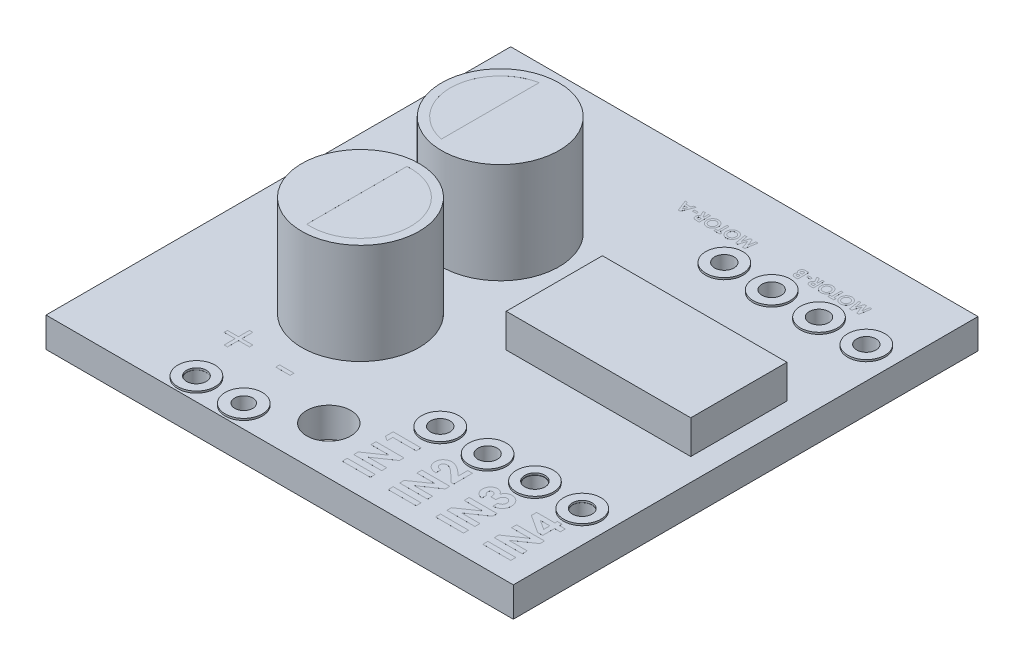
from build123d import *

# Parameters (mm, degrees)
SKETCH1_W                = 25.07
SKETCH1_H                = 24.93
BOSS_EXTRUDE1_DEPTH      = 1.6
SKETCH2_R                = 0.52
CUT_EXTRUDE1_DEPTH       = 1.6
LPATTERN1_COUNT          = 2
LPATTERN1_PITCH          = 2.54
SKETCH3_W                = 9.9
SKETCH3_H                = 5.16
BOSS_EXTRUDE2_DEPTH      = 1.8
SKETCH4_R                = 3.15
BOSS_EXTRUDE3_DEPTH      = 5.4
BOSS_EXTRUDE3_2_DEPTH    = 5.4
SKETCH7_R                = 1.185
CUT_EXTRUDE2_DEPTH       = 1.66
CUT_EXTRUDE3_DEPTH       = 0.001
SKETCH9_W                = 0.769230769
SKETCH9_H                = 0.205128205
BOSS_EXTRUDE4_DEPTH      = 0.001
SKETCH10_W               = 1.5
SKETCH10_H               = 0.269230769
BOSS_EXTRUDE5_DEPTH      = 0.001
SKETCH11_W               = 0.207692308
SKETCH11_H               = 0.1
SKETCH11_W_2             = 0.207692307
BOSS_EXTRUDE6_DEPTH      = 0.001
BOSS_EXTRUDE7_DEPTH      = 0.1
BOSS_EXTRUDE7_DEPTH_BACK = 1.7
SKETCH12_R               = 1
SKETCH12_R_2             = 0.52
SKETCH12_R_3             = 0.52732385
SKETCH12_R_4             = 0.484735271
SKETCH12_R_5             = 0.542856602
SKETCH12_R_6             = 0.528647699


with BuildPart() as part:
    # Sketch1 → Boss-Extrude1 (new body)
    with BuildSketch(Plane(origin=(0, 0, 0), x_dir=(1, 0, 0), z_dir=(0, 1, 0))):
        Rectangle(SKETCH1_W, SKETCH1_H)
    extrude(amount=BOSS_EXTRUDE1_DEPTH)

    # Sketch2 → Cut-Extrude1 (cut)
    with BuildSketch(Plane(origin=(0, 1.6, 0), x_dir=(1, 0, 0), z_dir=(0, 1, 0))):
        with Locations(Location((10.935, 8.075, 0), (0, 0, 270))):
            Circle(SKETCH2_R)
        with Locations(Location((10.935, -7.165, 0), (0, 0, 270))):
            Circle(SKETCH2_R)
        with Locations(Location((5.855, -7.165, 0), (0, 0, 270))):
            Circle(SKETCH2_R)
        with Locations(Location((5.855, 8.075, 0), (0, 0, 270))):
            Circle(SKETCH2_R)
        with Locations(Location((-3.035, -11.355, 0), (0, 0, 270))):
            Circle(SKETCH2_R)
    cut_extrude1 = extrude(amount=-CUT_EXTRUDE1_DEPTH, mode=Mode.SUBTRACT)

    # LPattern1: Cut-Extrude1 ×2
    with Locations(*[(-i * LPATTERN1_PITCH, 0, 0) for i in range(1, LPATTERN1_COUNT)]):
        add(cut_extrude1, mode=Mode.SUBTRACT)

    # Sketch7 → Cut-Extrude2 (cut)
    with BuildSketch(Plane(origin=(0, 1.6, 0), x_dir=(1, 0, 0), z_dir=(0, 1, 0))):
        with Locations(Location((0.075, -9.905, 0), (0, 0, 270))):
            Circle(SKETCH7_R)
    extrude(amount=-CUT_EXTRUDE2_DEPTH, mode=Mode.SUBTRACT)

    # Sketch9 → Boss-Extrude4 (add)
    with BuildSketch(Plane(origin=(0, 1.6, 0), x_dir=(1, 0, 0), z_dir=(0, 1, 0))):
        Polygon((-6.363977104, -8.310658231), (-6.363977104, -7.720914641), (-6.184489924, -7.720914641), (-6.184489924, -8.310658231), (-5.594746335, -8.310658231), (-5.594746335, -8.49014541), (-6.184489924, -8.49014541), (-6.184489924, -9.079889), (-6.363977104, -9.079889), (-6.363977104, -8.49014541), (-6.953720694, -8.49014541), (-6.953720694, -8.310658231), align=None)
        with Locations((-3.567566848, -8.618350538)):
            Rectangle(SKETCH9_W, SKETCH9_H)
    extrude(amount=BOSS_EXTRUDE4_DEPTH)

    # Sketch10 → Boss-Extrude5 (add)
    # profile 1 of 12: a face of its own
    with BuildSketch(Plane(origin=(0, 1.6, 0), x_dir=(1, 0, 0), z_dir=(0, 1, 0))):
        Polygon((2.203422881, -8.99396824), (2.203422881, -8.577802374), (3.703422881, -8.577802374), (3.703422881, -8.847033143), (2.453422881, -8.847033143), (2.453422881, -9.154725451), align=None)
    # profile 2 of 12: a face of its own
    with BuildSketch(Plane(origin=(0, 1.6, 0), x_dir=(1, 0, 0), z_dir=(0, 1, 0))):
        Polygon((2.203422881, -10.69318699), (2.203422881, -10.450699009), (3.190502208, -9.770110066), (2.203422881, -9.770110066), (2.203422881, -9.500879297), (3.703422881, -9.500879297), (3.703422881, -9.745170163), (2.719348361, -10.42395622), (3.703422881, -10.42395622), (3.703422881, -10.69318699), align=None)
    # profile 3 of 12: a face of its own
    with BuildSketch(Plane(origin=(0, 1.6, 0), x_dir=(1, 0, 0), z_dir=(0, 1, 0))):
        with Locations((2.953422881, -11.173956221)):
            Rectangle(SKETCH10_W, SKETCH10_H)
    # profile 4 of 12: a face of its own
    with BuildSketch(Plane(origin=(0, 1.6, 0), x_dir=(1, 0, 0), z_dir=(0, 1, 0))):
        with BuildLine():
            Line((5.255, -9.071812896), (5.255, -9.341043666))
            add(Edge.make_bspline(
                [(5.255, -9.341043666), (5.234633904, -9.339881356), (5.194839774, -9.337610272), (5.1370411, -9.328566566), (5.082414347, -9.316479449), (5.031123742, -9.300209891), (4.983147738, -9.28017028), (4.938645252, -9.255861854), (4.897297404, -9.228010375), (4.859829351, -9.196054445), (4.826144433, -9.161291), (4.796696193, -9.123809162), (4.772044164, -9.083715403), (4.751821993, -9.041277821), (4.735641652, -8.996663106), (4.724829479, -8.949420489), (4.717505786, -8.899966825), (4.716865037, -8.866111486), (4.716538462, -8.848856166)],
                knots=[0, 0, 0, 0, 1.198928049, 2.342633425, 3.435730849, 4.486331048, 5.502589352, 6.488331875, 7.46361919, 8.428949135, 9.378681775, 10.305958057, 11.226249248, 12.140413166, 13.066341608, 14.010670971, 14.986082777, 16, 16, 16, 16], degree=3))
            add(Edge.make_bspline(
                [(4.716538462, -8.848856166), (4.717154926, -8.827665993), (4.718358939, -8.786279632), (4.729986855, -8.726341858), (4.747793102, -8.670063713), (4.773663124, -8.618043838), (4.80628543, -8.570372676), (4.845257911, -8.527315261), (4.891054017, -8.489711352), (4.942354937, -8.457854215), (4.996783884, -8.431510041), (5.052962884, -8.412871965), (5.109441982, -8.400685907), (5.147467646, -8.399383158), (5.166358173, -8.398735973)],
                knots=[0, 0, 0, 0, 1.075374184, 2.100304875, 3.089917907, 4.066149699, 5.039978333, 6.01615708, 7.006437042, 8.039858286, 9.077679641, 10.07047942, 11.041445745, 12, 12, 12, 12], degree=3))
            add(Edge.make_bspline(
                [(5.166358173, -8.398735973), (5.17778472, -8.39898763), (5.200783535, -8.399494152), (5.235586388, -8.403016066), (5.271037162, -8.408299635), (5.307105466, -8.416265963), (5.343801391, -8.426200651), (5.38123483, -8.438252773), (5.419193258, -8.452702317), (5.458105037, -8.469306481), (5.498091908, -8.489120881), (5.539772216, -8.512169003), (5.583101589, -8.539221396), (5.628505028, -8.569397424), (5.675289274, -8.603884219), (5.723973829, -8.64176826), (5.774481981, -8.683240243), (5.808259141, -8.712651609), (5.825612981, -8.727762416)],
                knots=[0, 0, 0, 0, 0.728277616, 1.465842947, 2.227925269, 3.011838508, 3.818735656, 4.650581052, 5.517389122, 6.406849312, 7.346234817, 8.360743166, 9.441530624, 10.601362564, 11.834937575, 13.145232671, 14.533293658, 16, 16, 16, 16], degree=3))
            Line((5.825612981, -8.727762416), (6.005, -8.884312896))
            Line((6.005, -8.884312896), (6.005, -8.379505204))
            Line((6.005, -8.379505204), (6.255, -8.379505204))
            Line((6.255, -8.379505204), (6.255, -9.379505204))
            Line((6.255, -9.379505204), (6.118581731, -9.379505204))
            Line((6.118581731, -9.379505204), (5.645925481, -8.935394627))
            add(Edge.make_bspline(
                [(5.645925481, -8.935394627), (5.632138088, -8.922536281), (5.605435998, -8.897633478), (5.566218897, -8.862202662), (5.529010838, -8.830129104), (5.493380329, -8.802129964), (5.460533774, -8.776511214), (5.429229448, -8.755079245), (5.400348934, -8.736414627), (5.365144738, -8.71691746), (5.323474587, -8.697975447), (5.275498535, -8.680605924), (5.229612325, -8.67012413), (5.199658353, -8.668666172), (5.185288462, -8.667966742)],
                knots=[0, 0, 0, 0, 1.246192343, 2.413505005, 3.49357156, 4.492416076, 5.408771964, 6.246246772, 6.999304986, 7.680960093, 8.904522682, 10.020616941, 11.0504258, 12, 12, 12, 12], degree=3))
            add(Edge.make_bspline(
                [(5.185288462, -8.667966742), (5.171386204, -8.668488309), (5.14444835, -8.669498928), (5.106129397, -8.680604814), (5.071435497, -8.697810437), (5.041403343, -8.722055591), (5.01672393, -8.751424065), (4.998368076, -8.785362095), (4.987776832, -8.823592987), (4.986451187, -8.850393571), (4.985769231, -8.864180685)],
                knots=[0, 0, 0, 0, 1.062038974, 2.057870785, 3.028805853, 4.01125022, 4.991535629, 5.949134679, 6.94496649, 8, 8, 8, 8], degree=3))
            add(Edge.make_bspline(
                [(4.985769231, -8.864180685), (4.986021154, -8.871303283), (4.986517104, -8.885325263), (4.989818512, -8.905936477), (4.995636899, -8.925549527), (5.003432718, -8.944382719), (5.013766132, -8.962235059), (5.026503712, -8.979061518), (5.041321766, -8.995039384), (5.05817396, -9.010095377), (5.076981014, -9.023798295), (5.097571163, -9.035969177), (5.119931627, -9.046032471), (5.143767213, -9.05489256), (5.169333935, -9.061725885), (5.19647878, -9.066701393), (5.225157584, -9.07048394), (5.244871566, -9.071361852), (5.255, -9.071812896)],
                knots=[0, 0, 0, 0, 0.903469896, 1.778625579, 2.63899355, 3.493148037, 4.358286772, 5.247621495, 6.164656832, 7.118446693, 8.109501108, 9.111810964, 10.146451449, 11.215617525, 12.33435995, 13.498009769, 14.714554818, 16, 16, 16, 16], degree=3))
        make_face()
    # profile 5 of 12: a face of its own
    with BuildSketch(Plane(origin=(0, 1.6, 0), x_dir=(1, 0, 0), z_dir=(0, 1, 0))):
        Polygon((4.755, -10.783351358), (4.755, -10.540863377), (5.742079327, -9.860274435), (4.755, -9.860274435), (4.755, -9.591043666), (6.255, -9.591043666), (6.255, -9.835334531), (5.270925481, -10.514120589), (6.255, -10.514120589), (6.255, -10.783351358), align=None)
    # profile 6 of 12: a face of its own
    with BuildSketch(Plane(origin=(0, 1.6, 0), x_dir=(1, 0, 0), z_dir=(0, 1, 0))):
        with Locations((5.505, -11.264120589)):
            Rectangle(SKETCH10_W, SKETCH10_H)
    # profile 7 of 12: a face of its own
    with BuildSketch(Plane(origin=(0, 1.6, 0), x_dir=(1, 0, 0), z_dir=(0, 1, 0))):
        with BuildLine():
            Line((7.660384615, -9.014120589), (7.660384615, -9.283351358))
            add(Edge.make_bspline(
                [(7.660384615, -9.283351358), (7.646923785, -9.281462344), (7.620631451, -9.277772633), (7.582475644, -9.26870231), (7.546192287, -9.25821303), (7.5119761, -9.244798725), (7.479863969, -9.22931433), (7.449827158, -9.211257424), (7.421434614, -9.191465859), (7.404419841, -9.175970301), (7.395961538, -9.168267223)],
                knots=[0, 0, 0, 0, 1.1115466, 2.171125598, 3.205689823, 4.19946166, 5.17440286, 6.118867946, 7.064860634, 8, 8, 8, 8], degree=3))
            add(Edge.make_bspline(
                [(7.395961538, -9.168267223), (7.384784168, -9.157183956), (7.362754744, -9.135340001), (7.334537486, -9.09883619), (7.310117369, -9.060573455), (7.290756923, -9.01978442), (7.275086885, -8.977103793), (7.264561285, -8.932192162), (7.257577456, -8.885233054), (7.256889525, -8.85318937), (7.256538462, -8.836836935)],
                knots=[0, 0, 0, 0, 1.01925491, 2.00884431, 2.983262333, 3.955970413, 4.92937149, 5.924503185, 6.940838805, 8, 8, 8, 8], degree=3))
            add(Edge.make_bspline(
                [(7.256538462, -8.836836935), (7.256881679, -8.822298779), (7.257556375, -8.793719693), (7.26297247, -8.751715629), (7.272471698, -8.711668269), (7.284891724, -8.6731543), (7.301791247, -8.636740139), (7.321407995, -8.601622088), (7.345468752, -8.568781348), (7.372654986, -8.538141078), (7.402059559, -8.509992146), (7.43349063, -8.485615047), (7.466108602, -8.464657618), (7.500184468, -8.447391468), (7.53577589, -8.434116146), (7.57267726, -8.424902678), (7.610807152, -8.41887224), (7.636723527, -8.418271451), (7.649867788, -8.417966742)],
                knots=[0, 0, 0, 0, 1.091422571, 2.145516843, 3.172569842, 4.178562979, 5.178154469, 6.181868002, 7.194278174, 8.227918432, 9.254613415, 10.245994977, 11.209837596, 12.161663635, 13.10878368, 14.055455738, 15.013766427, 16, 16, 16, 16], degree=3))
            add(Edge.make_bspline(
                [(7.649867788, -8.417966742), (7.666142972, -8.418604061), (7.698281955, -8.419862589), (7.745227197, -8.429815699), (7.790013276, -8.445815892), (7.832109541, -8.468565794), (7.87147214, -8.497134701), (7.906726315, -8.532169052), (7.938418038, -8.572691177), (7.955449388, -8.60311083), (7.964170673, -8.618687896)],
                knots=[0, 0, 0, 0, 0.992776698, 1.96045919, 2.915875678, 3.886951799, 4.871409521, 5.874469288, 6.911574252, 8, 8, 8, 8], degree=3))
            add(Edge.make_bspline(
                [(7.964170673, -8.618687896), (7.967680588, -8.607995637), (7.974577414, -8.586985827), (7.988169025, -8.55712893), (8.00299084, -8.528715064), (8.020293725, -8.502394045), (8.038878373, -8.477444081), (8.059744027, -8.454654555), (8.082355098, -8.43343534), (8.106952125, -8.414311373), (8.13312615, -8.397213661), (8.160406731, -8.382145614), (8.188893576, -8.36950069), (8.218377346, -8.358887869), (8.249148208, -8.35079058), (8.281101885, -8.345093844), (8.314161386, -8.341799919), (8.336559332, -8.341297638), (8.347884615, -8.341043666)],
                knots=[0, 0, 0, 0, 1.059375415, 2.081625174, 3.086260357, 4.075579879, 5.045586876, 6.014170127, 6.982201689, 7.963705737, 8.945119069, 9.924852636, 10.896327119, 11.878239286, 12.873838556, 13.889973282, 14.933087432, 16, 16, 16, 16], degree=3))
            add(Edge.make_bspline(
                [(8.347884615, -8.341043666), (8.36452817, -8.341558545), (8.397345869, -8.342573781), (8.445682891, -8.34902834), (8.491768295, -8.361045097), (8.536130718, -8.376855355), (8.57820355, -8.397938732), (8.618929138, -8.422771598), (8.656926372, -8.453167797), (8.692924452, -8.487254284), (8.725811949, -8.524911676), (8.754868417, -8.565433472), (8.778820866, -8.608898182), (8.799293926, -8.654254996), (8.814488156, -8.702525704), (8.825615097, -8.753085889), (8.832385066, -8.806304762), (8.833097628, -8.842626239), (8.833461538, -8.861175877)],
                knots=[0, 0, 0, 0, 1.005228408, 1.982105694, 2.937129188, 3.876607107, 4.82066901, 5.774063015, 6.75178259, 7.752926466, 8.764612432, 9.766578198, 10.757677051, 11.756882247, 12.76686714, 13.807379907, 14.880213281, 16, 16, 16, 16], degree=3))
            add(Edge.make_bspline(
                [(8.833461538, -8.861175877), (8.833078734, -8.878723909), (8.832330212, -8.913036762), (8.825851368, -8.963226492), (8.815400468, -9.01092708), (8.800669058, -9.056260258), (8.781564936, -9.099050635), (8.758816214, -9.139686253), (8.731110797, -9.177356235), (8.699699361, -9.212480299), (8.664457514, -9.244279289), (8.626201615, -9.272700097), (8.584786192, -9.29711604), (8.540388191, -9.317627248), (8.492929722, -9.334073369), (8.442507296, -9.347046022), (8.389022403, -9.356107632), (8.352223658, -9.358867364), (8.333461538, -9.360274435)],
                knots=[0, 0, 0, 0, 1.066544725, 2.085487077, 3.070979577, 4.031932826, 4.977951092, 5.916076795, 6.857635327, 7.814973522, 8.776389752, 9.738577119, 10.707772778, 11.69409279, 12.707140348, 13.757286496, 14.856535458, 16, 16, 16, 16], degree=3))
            Line((8.333461538, -9.360274435), (8.333461538, -9.091043666))
            add(Edge.make_bspline(
                [(8.333461538, -9.091043666), (8.342895221, -9.089337245), (8.361269793, -9.086013545), (8.387874703, -9.079536733), (8.412423015, -9.071074345), (8.435095079, -9.061399324), (8.45612357, -9.050702453), (8.47494615, -9.037921546), (8.492302547, -9.024217579), (8.512252557, -9.003617394), (8.53317436, -8.974875416), (8.551703667, -8.935960468), (8.562241982, -8.892473794), (8.563553098, -8.862133953), (8.564230769, -8.846452319)],
                knots=[0, 0, 0, 0, 0.928450228, 1.808400301, 2.64896863, 3.43999153, 4.194978884, 4.9294959, 5.640047715, 6.332896648, 7.70085756, 9.063442004, 10.482192841, 12, 12, 12, 12], degree=3))
            add(Edge.make_bspline(
                [(8.564230769, -8.846452319), (8.564087259, -8.838129938), (8.563806154, -8.821828256), (8.560718767, -8.797877399), (8.555574782, -8.77508421), (8.548773757, -8.753259398), (8.539544803, -8.732745948), (8.528834633, -8.713079398), (8.515723764, -8.694619409), (8.500785172, -8.677473517), (8.484833507, -8.661516414), (8.467378204, -8.647890896), (8.449257407, -8.636127306), (8.429991816, -8.626845041), (8.41018961, -8.61907636), (8.389221391, -8.614231155), (8.367542304, -8.610594747), (8.352708666, -8.610382271), (8.345180288, -8.610274435)],
                knots=[0, 0, 0, 0, 1.110702965, 2.175618623, 3.217100552, 4.227908035, 5.221854906, 6.215531843, 7.213608581, 8.237687243, 9.249555755, 10.220750668, 11.188994735, 12.127982202, 13.071814005, 14.022160605, 14.996205625, 16, 16, 16, 16], degree=3))
            add(Edge.make_bspline(
                [(8.345180288, -8.610274435), (8.336944046, -8.610548659), (8.320646093, -8.611091297), (8.296762223, -8.615866482), (8.273698898, -8.62301423), (8.251646408, -8.633294018), (8.230734445, -8.646745579), (8.210789818, -8.663101297), (8.191971316, -8.682509131), (8.17373087, -8.704319164), (8.157763269, -8.729411393), (8.143059497, -8.756772555), (8.131351671, -8.787076714), (8.120896967, -8.819596869), (8.113260376, -8.854944476), (8.107715652, -8.892901106), (8.10358841, -8.933405216), (8.102996293, -8.96132524), (8.102692308, -8.97565905)],
                knots=[0, 0, 0, 0, 0.809868251, 1.602574917, 2.388262527, 3.182133002, 3.988875265, 4.829537611, 5.714850619, 6.646378958, 7.622533229, 8.636771727, 9.698525113, 10.814716514, 11.996253919, 13.252421425, 14.589425562, 16, 16, 16, 16], degree=3))
            Line((8.102692308, -8.97565905), (7.852692308, -8.97565905))
            add(Edge.make_bspline(
                [(7.852692308, -8.97565905), (7.851178126, -8.957810428), (7.848345392, -8.92441919), (7.841627698, -8.878102238), (7.832937539, -8.838976569), (7.821611908, -8.806594967), (7.808382754, -8.779262124), (7.79305456, -8.755719549), (7.775452997, -8.735179358), (7.755603714, -8.718284194), (7.734797617, -8.704204561), (7.712669248, -8.694566309), (7.690099029, -8.68810607), (7.674650135, -8.687498542), (7.666995192, -8.687197512)],
                knots=[0, 0, 0, 0, 1.700711886, 3.181695139, 4.441392523, 5.500267777, 6.431839453, 7.31822765, 8.161090383, 8.990537424, 9.787217293, 10.536619396, 11.274893404, 12, 12, 12, 12], degree=3))
            add(Edge.make_bspline(
                [(7.666995192, -8.687197512), (7.657227324, -8.687714723), (7.638162513, -8.688724209), (7.61082809, -8.696718194), (7.5863326, -8.710284317), (7.564950034, -8.728691384), (7.547507994, -8.751304666), (7.534535607, -8.777475421), (7.526967994, -8.807071038), (7.526177868, -8.827878571), (7.525769231, -8.838639819)],
                knots=[0, 0, 0, 0, 1.009324788, 1.969988301, 2.915956825, 3.885795408, 4.868116622, 5.850437836, 6.888288533, 8, 8, 8, 8], degree=3))
            add(Edge.make_bspline(
                [(7.525769231, -8.838639819), (7.526249392, -8.848394835), (7.52720218, -8.867751775), (7.534313536, -8.896057415), (7.546284619, -8.922938342), (7.562792037, -8.947837929), (7.582616746, -8.970396744), (7.606094998, -8.988911023), (7.631820172, -9.004310323), (7.650825808, -9.01083768), (7.660384615, -9.014120589)],
                knots=[0, 0, 0, 0, 0.98818071, 1.960853194, 2.938124878, 3.957524365, 4.978590984, 5.968022688, 6.978025184, 8, 8, 8, 8], degree=3))
        make_face()
    # profile 8 of 12: a face of its own
    with BuildSketch(Plane(origin=(0, 1.6, 0), x_dir=(1, 0, 0), z_dir=(0, 1, 0))):
        Polygon((7.295, -10.783351358), (7.295, -10.540863377), (8.282079327, -9.860274435), (7.295, -9.860274435), (7.295, -9.591043666), (8.795, -9.591043666), (8.795, -9.835334531), (7.810925481, -10.514120589), (8.795, -10.514120589), (8.795, -10.783351358), align=None)
    # profile 9 of 12: a face of its own
    with BuildSketch(Plane(origin=(0, 1.6, 0), x_dir=(1, 0, 0), z_dir=(0, 1, 0))):
        with Locations((8.045, -11.264120589)):
            Rectangle(SKETCH10_W, SKETCH10_H)
    # profile 10 of 12: a face of its own
    with BuildSketch(Plane(origin=(0, 1.6, 0), x_dir=(1, 0, 0), z_dir=(0, 1, 0))):
        Polygon((9.796538462, -8.756308089), (9.796538462, -8.47565905), (10.777307692, -8.47565905), (10.777307692, -8.341043666), (11.027307692, -8.341043666), (11.027307692, -8.47565905), (11.335, -8.47565905), (11.335, -8.744889819), (11.027307692, -8.744889819), (11.027307692, -9.379505204), (10.754771635, -9.379505204), align=None)
        Polygon((10.777307692, -8.744889819), (10.266790865, -8.744889819), (10.777307692, -9.076921069), align=None, mode=Mode.SUBTRACT)
    # profile 11 of 12: a face of its own
    with BuildSketch(Plane(origin=(0, 1.6, 0), x_dir=(1, 0, 0), z_dir=(0, 1, 0))):
        Polygon((9.835, -10.783351358), (9.835, -10.540863377), (10.822079327, -9.860274435), (9.835, -9.860274435), (9.835, -9.591043666), (11.335, -9.591043666), (11.335, -9.835334531), (10.350925481, -10.514120589), (11.335, -10.514120589), (11.335, -10.783351358), align=None)
    # profile 12 of 12: a face of its own
    with BuildSketch(Plane(origin=(0, 1.6, 0), x_dir=(1, 0, 0), z_dir=(0, 1, 0))):
        with Locations((10.585, -11.264120589)):
            Rectangle(SKETCH10_W, SKETCH10_H)
    extrude(amount=BOSS_EXTRUDE5_DEPTH)

    # Sketch11 → Boss-Extrude6 (add)
    # profile 1 of 14: a face of its own
    with BuildSketch(Plane(origin=(0, 1.6, 0), x_dir=(1, 0, 0), z_dir=(0, 1, 0))):
        Polygon((9.233145959, 9.372522891), (9.121367113, 9.372522891), (8.984468074, 9.791032506), (8.846607498, 9.372522891), (8.735910382, 9.372522891), (8.634468074, 9.972522891), (8.743482498, 9.972522891), (8.807544998, 9.593556544), (8.932304613, 9.972522891), (9.03735269, 9.972522891), (9.161391151, 9.593556544), (9.225333459, 9.972522891), (9.334468074, 9.972522891), align=None)
    # profile 2 of 14: a face of its own
    with BuildSketch(Plane(origin=(0, 1.6, 0), x_dir=(1, 0, 0), z_dir=(0, 1, 0))):
        with BuildLine():
            add(Edge.make_bspline(
                [(8.252496921, 9.357138275), (8.242065133, 9.357408263), (8.221470422, 9.35794128), (8.191183936, 9.362387743), (8.161993805, 9.369624279), (8.133895848, 9.379725318), (8.10698589, 9.392807069), (8.081165058, 9.408690859), (8.056504112, 9.427511468), (8.033290573, 9.449000326), (8.012004326, 9.472497719), (7.993293473, 9.497549325), (7.97741033, 9.523896497), (7.964517945, 9.551544369), (7.954449922, 9.580454962), (7.947452765, 9.610639248), (7.942941163, 9.642058576), (7.942423483, 9.663452665), (7.942160382, 9.674325775)],
                knots=[0, 0, 0, 0, 1.014151002, 2.002163778, 2.969868608, 3.93493411, 4.9003771, 5.874719092, 6.87846472, 7.912488755, 8.947011879, 9.957751389, 10.948740761, 11.933621513, 12.919426746, 13.920294397, 14.943031967, 16, 16, 16, 16], degree=3))
            add(Edge.make_bspline(
                [(7.942160382, 9.674325775), (7.942440661, 9.68507635), (7.942992961, 9.706260702), (7.947268036, 9.737390783), (7.954386806, 9.76725065), (7.964260729, 9.79585051), (7.976927689, 9.823190833), (7.992568265, 9.849182903), (8.011079699, 9.873880124), (8.032083855, 9.897131193), (8.055064949, 9.918373526), (8.07955089, 9.937021685), (8.10531419, 9.952706508), (8.132190243, 9.965725248), (8.160432595, 9.975508461), (8.189728125, 9.982831224), (8.220321897, 9.987065649), (8.241105974, 9.987624065), (8.251655574, 9.987907506)],
                knots=[0, 0, 0, 0, 1.051517626, 2.07204922, 3.067438659, 4.05042616, 5.027204762, 6.009981242, 7.012629434, 8.042243656, 9.071350414, 10.070091277, 11.048190212, 12.017682766, 12.985867053, 13.966945899, 14.968060614, 16, 16, 16, 16], degree=3))
            add(Edge.make_bspline(
                [(8.251655574, 9.987907506), (8.262690045, 9.987656226), (8.284371272, 9.987162496), (8.31610972, 9.98250695), (8.346474558, 9.975408951), (8.375382585, 9.965132756), (8.402811328, 9.951780271), (8.428883794, 9.935658165), (8.453403895, 9.916455017), (8.476289897, 9.894750026), (8.497022255, 9.870993846), (8.515323259, 9.845899147), (8.530760403, 9.819655706), (8.543334481, 9.79225174), (8.553247368, 9.763857428), (8.560239786, 9.734299876), (8.564370374, 9.703649964), (8.564945741, 9.682831931), (8.565237305, 9.672282506)],
                knots=[0, 0, 0, 0, 1.067953136, 2.098381936, 3.099641766, 4.083805132, 5.062469929, 6.048665414, 7.046702845, 8.073106546, 9.098695993, 10.09591865, 11.076726721, 12.041940862, 13.011263376, 13.984305721, 14.978557872, 16, 16, 16, 16], degree=3))
            add(Edge.make_bspline(
                [(8.565237305, 9.672282506), (8.565144533, 9.665185713), (8.564960164, 9.651081988), (8.562788002, 9.630175563), (8.559566422, 9.609707168), (8.555156156, 9.589638314), (8.54921406, 9.57002072), (8.541991926, 9.550804901), (8.533575863, 9.531990963), (8.523870679, 9.513749052), (8.51289218, 9.496297422), (8.501170105, 9.479483651), (8.488255474, 9.463749131), (8.474414851, 9.448922949), (8.459594023, 9.435072878), (8.443767177, 9.422151626), (8.426959226, 9.410192149), (8.409351969, 9.399095621), (8.391005637, 9.389376786), (8.372356724, 9.380567374), (8.353226202, 9.373424705), (8.333752972, 9.367508922), (8.313981804, 9.362761266), (8.293760048, 9.359604479), (8.273258371, 9.357415157), (8.259433828, 9.357230788), (8.252496921, 9.357138275)],
                knots=[0, 0, 0, 0, 1.034641744, 2.056182551, 3.061960284, 4.05571729, 5.050247014, 6.048716841, 7.047801973, 8.054190544, 9.059424999, 10.053182006, 11.041513076, 12.025412457, 13.009311837, 13.997642908, 15.002928308, 16.016213968, 17.030509951, 18.02913364, 19.022134519, 20.005478534, 20.996155877, 21.984625117, 22.988721131, 24, 24, 24, 24], degree=3))
        make_face()
        with BuildLine():
            add(Edge.make_bspline(
                [(8.254179613, 9.464830583), (8.261200169, 9.46501896), (8.275055938, 9.465390742), (8.295379832, 9.46822321), (8.314891467, 9.472747001), (8.333482785, 9.479299595), (8.351233976, 9.487639607), (8.368177956, 9.49773689), (8.384074592, 9.509942384), (8.399157043, 9.523586221), (8.412735608, 9.53885139), (8.424944578, 9.555032384), (8.434816025, 9.572518544), (8.44330406, 9.590733924), (8.449573787, 9.610139171), (8.45434753, 9.630419339), (8.456947626, 9.65178262), (8.457343037, 9.666306547), (8.457544998, 9.673724814)],
                knots=[0, 0, 0, 0, 1.033668485, 2.040047952, 3.016132939, 3.979056467, 4.937231767, 5.900589077, 6.877725736, 7.88429546, 8.891280164, 9.882584218, 10.863295226, 11.842887319, 12.837417301, 13.860812229, 14.907384602, 16, 16, 16, 16], degree=3))
            add(Edge.make_bspline(
                [(8.457544998, 9.673724814), (8.457299505, 9.681948212), (8.456818379, 9.698064709), (8.453482369, 9.721587624), (8.44763703, 9.743777125), (8.439651593, 9.764707441), (8.429036668, 9.784158479), (8.416340979, 9.802366051), (8.401246653, 9.819217187), (8.389638541, 9.829063779), (8.383746921, 9.834061352)],
                knots=[0, 0, 0, 0, 1.078343132, 2.113373867, 3.107373148, 4.082093053, 5.043582658, 6.005574554, 6.987742499, 8, 8, 8, 8], degree=3))
            add(Edge.make_bspline(
                [(8.383746921, 9.834061352), (8.378919273, 9.837752782), (8.369372745, 9.845052473), (8.354134408, 9.854408524), (8.338441922, 9.862427593), (8.322176867, 9.868906906), (8.305373593, 9.874003424), (8.288034406, 9.877572433), (8.270183873, 9.879812294), (8.258112506, 9.88008), (8.252016151, 9.880215198)],
                knots=[0, 0, 0, 0, 1.023928204, 2.024787132, 3.009472467, 3.9914905, 4.972207045, 5.96565515, 6.972602802, 8, 8, 8, 8], degree=3))
            add(Edge.make_bspline(
                [(8.252016151, 9.880215198), (8.245116447, 9.880024954), (8.231541063, 9.879650642), (8.211593601, 9.876856893), (8.192492191, 9.872108168), (8.174059784, 9.865659573), (8.156543201, 9.857017338), (8.139669287, 9.846755347), (8.123639148, 9.83455355), (8.108648203, 9.820565877), (8.094909803, 9.805299988), (8.082755142, 9.789031473), (8.072689079, 9.771759699), (8.064292702, 9.753715379), (8.057750989, 9.734754844), (8.053274135, 9.714876663), (8.050396946, 9.694161036), (8.050036377, 9.680064682), (8.04985269, 9.672883468)],
                knots=[0, 0, 0, 0, 1.026350473, 2.019376834, 2.989435443, 3.95094063, 4.91865229, 5.889827372, 6.885283771, 7.910196595, 8.935871797, 9.9372888, 10.925850568, 11.904605667, 12.894245083, 13.903507864, 14.931967858, 16, 16, 16, 16], degree=3))
            add(Edge.make_bspline(
                [(8.04985269, 9.672883468), (8.050042021, 9.665743253), (8.050414692, 9.651688829), (8.053224097, 9.631030669), (8.057894639, 9.611261712), (8.064495607, 9.592330998), (8.07271904, 9.574139144), (8.083049041, 9.556844038), (8.095261701, 9.540460643), (8.109133764, 9.525086362), (8.124230168, 9.510957435), (8.140438321, 9.498696336), (8.157303925, 9.488041768), (8.175214162, 9.479695425), (8.193802552, 9.473045907), (8.213182535, 9.468149108), (8.23342751, 9.46541064), (8.247200586, 9.465025659), (8.254179613, 9.464830583)],
                knots=[0, 0, 0, 0, 1.055040155, 2.076685641, 3.074845078, 4.052329834, 5.035358467, 6.020382375, 7.023447318, 8.050688466, 9.077178457, 10.074336316, 11.0503314, 12.019748348, 12.988025369, 13.964577102, 14.968620271, 16, 16, 16, 16], degree=3))
        make_face(mode=Mode.SUBTRACT)
    # profile 3 of 14: a face of its own
    with BuildSketch(Plane(origin=(0, 1.6, 0), x_dir=(1, 0, 0), z_dir=(0, 1, 0))):
        Polygon((7.896006536, 9.372522891), (7.572929613, 9.372522891), (7.572929613, 9.480215198), (7.680621921, 9.480215198), (7.680621921, 9.972522891), (7.788314228, 9.972522891), (7.788314228, 9.480215198), (7.896006536, 9.480215198), align=None)
    # profile 4 of 14: a face of its own
    with BuildSketch(Plane(origin=(0, 1.6, 0), x_dir=(1, 0, 0), z_dir=(0, 1, 0))):
        with BuildLine():
            add(Edge.make_bspline(
                [(7.206343074, 9.357138275), (7.195911287, 9.357408263), (7.175316576, 9.35794128), (7.145030089, 9.362387743), (7.115839959, 9.369624279), (7.087742002, 9.379725318), (7.060832044, 9.392807069), (7.035011212, 9.408690859), (7.010350266, 9.427511468), (6.987136727, 9.449000326), (6.96585048, 9.472497719), (6.947139627, 9.497549325), (6.931256484, 9.523896497), (6.918364099, 9.551544369), (6.908296076, 9.580454962), (6.901298918, 9.610639248), (6.896787317, 9.642058576), (6.896269637, 9.663452665), (6.896006536, 9.674325775)],
                knots=[0, 0, 0, 0, 1.014151002, 2.002163778, 2.969868608, 3.93493411, 4.9003771, 5.874719092, 6.87846472, 7.912488755, 8.947011879, 9.957751389, 10.948740761, 11.933621513, 12.919426746, 13.920294397, 14.943031967, 16, 16, 16, 16], degree=3))
            add(Edge.make_bspline(
                [(6.896006536, 9.674325775), (6.896286815, 9.68507635), (6.896839114, 9.706260702), (6.901114189, 9.737390783), (6.90823296, 9.76725065), (6.918106883, 9.79585051), (6.930773842, 9.823190833), (6.946414419, 9.849182903), (6.964925853, 9.873880124), (6.985930009, 9.897131193), (7.008911103, 9.918373526), (7.033397044, 9.937021685), (7.059160344, 9.952706508), (7.086036397, 9.965725248), (7.114278749, 9.975508461), (7.143574279, 9.982831224), (7.174168051, 9.987065649), (7.194952128, 9.987624065), (7.205501728, 9.987907506)],
                knots=[0, 0, 0, 0, 1.051517626, 2.07204922, 3.067438659, 4.05042616, 5.027204762, 6.009981242, 7.012629434, 8.042243656, 9.071350414, 10.070091277, 11.048190212, 12.017682766, 12.985867053, 13.966945899, 14.968060614, 16, 16, 16, 16], degree=3))
            add(Edge.make_bspline(
                [(7.205501728, 9.987907506), (7.216536199, 9.987656226), (7.238217426, 9.987162496), (7.269955874, 9.98250695), (7.300320712, 9.975408951), (7.329228739, 9.965132756), (7.356657482, 9.951780271), (7.382729948, 9.935658165), (7.407250049, 9.916455017), (7.430136051, 9.894750026), (7.450868409, 9.870993846), (7.469169413, 9.845899147), (7.484606557, 9.819655706), (7.497180635, 9.79225174), (7.507093522, 9.763857428), (7.51408594, 9.734299876), (7.518216528, 9.703649964), (7.518791895, 9.682831931), (7.519083459, 9.672282506)],
                knots=[0, 0, 0, 0, 1.067953136, 2.098381936, 3.099641766, 4.083805132, 5.062469929, 6.048665414, 7.046702845, 8.073106546, 9.098695993, 10.09591865, 11.076726721, 12.041940862, 13.011263376, 13.984305721, 14.978557872, 16, 16, 16, 16], degree=3))
            add(Edge.make_bspline(
                [(7.519083459, 9.672282506), (7.518990687, 9.665185713), (7.518806317, 9.651081988), (7.516634156, 9.630175563), (7.513412576, 9.609707168), (7.509002309, 9.589638314), (7.503060214, 9.57002072), (7.49583808, 9.550804901), (7.487422017, 9.531990963), (7.477716833, 9.513749052), (7.466738334, 9.496297422), (7.455016259, 9.479483651), (7.442101628, 9.463749131), (7.428261005, 9.448922949), (7.413440176, 9.435072878), (7.397613331, 9.422151626), (7.38080538, 9.410192149), (7.363198123, 9.399095621), (7.344851791, 9.389376786), (7.326202878, 9.380567374), (7.307072356, 9.373424705), (7.287599126, 9.367508922), (7.267827958, 9.362761266), (7.247606202, 9.359604479), (7.227104525, 9.357415157), (7.213279982, 9.357230788), (7.206343074, 9.357138275)],
                knots=[0, 0, 0, 0, 1.034641744, 2.056182551, 3.061960284, 4.05571729, 5.050247014, 6.048716841, 7.047801973, 8.054190544, 9.059424999, 10.053182006, 11.041513076, 12.025412457, 13.009311837, 13.997642908, 15.002928308, 16.016213968, 17.030509951, 18.02913364, 19.022134519, 20.005478534, 20.996155877, 21.984625117, 22.988721131, 24, 24, 24, 24], degree=3))
        make_face()
        with BuildLine():
            add(Edge.make_bspline(
                [(7.208025767, 9.464830583), (7.215046323, 9.46501896), (7.228902091, 9.465390742), (7.249225986, 9.46822321), (7.268737621, 9.472747001), (7.287328939, 9.479299595), (7.30508013, 9.487639607), (7.32202411, 9.49773689), (7.337920746, 9.509942384), (7.353003197, 9.523586221), (7.366581762, 9.53885139), (7.378790731, 9.555032384), (7.388662179, 9.572518544), (7.397150214, 9.590733924), (7.403419941, 9.610139171), (7.408193684, 9.630419339), (7.41079378, 9.65178262), (7.411189191, 9.666306547), (7.411391151, 9.673724814)],
                knots=[0, 0, 0, 0, 1.033668485, 2.040047952, 3.016132939, 3.979056467, 4.937231767, 5.900589077, 6.877725736, 7.88429546, 8.891280164, 9.882584218, 10.863295226, 11.842887319, 12.837417301, 13.860812229, 14.907384602, 16, 16, 16, 16], degree=3))
            add(Edge.make_bspline(
                [(7.411391151, 9.673724814), (7.411145658, 9.681948212), (7.410664533, 9.698064709), (7.407328523, 9.721587624), (7.401483184, 9.743777125), (7.393497746, 9.764707441), (7.382882822, 9.784158479), (7.370187133, 9.802366051), (7.355092806, 9.819217187), (7.343484695, 9.829063779), (7.337593074, 9.834061352)],
                knots=[0, 0, 0, 0, 1.078343132, 2.113373867, 3.107373148, 4.082093053, 5.043582658, 6.005574554, 6.987742499, 8, 8, 8, 8], degree=3))
            add(Edge.make_bspline(
                [(7.337593074, 9.834061352), (7.332765427, 9.837752782), (7.323218899, 9.845052473), (7.307980562, 9.854408524), (7.292288076, 9.862427593), (7.276023021, 9.868906906), (7.259219747, 9.874003424), (7.24188056, 9.877572433), (7.224030027, 9.879812294), (7.21195866, 9.88008), (7.205862305, 9.880215198)],
                knots=[0, 0, 0, 0, 1.023928204, 2.024787132, 3.009472467, 3.9914905, 4.972207045, 5.96565515, 6.972602802, 8, 8, 8, 8], degree=3))
            add(Edge.make_bspline(
                [(7.205862305, 9.880215198), (7.198962601, 9.880024954), (7.185387217, 9.879650642), (7.165439755, 9.876856893), (7.146338345, 9.872108168), (7.127905937, 9.865659573), (7.110389355, 9.857017338), (7.093515441, 9.846755347), (7.077485302, 9.83455355), (7.062494357, 9.820565877), (7.048755957, 9.805299988), (7.036601296, 9.789031473), (7.026535233, 9.771759699), (7.018138856, 9.753715379), (7.011597142, 9.734754844), (7.007120288, 9.714876663), (7.0042431, 9.694161036), (7.003882531, 9.680064682), (7.003698844, 9.672883468)],
                knots=[0, 0, 0, 0, 1.026350473, 2.019376834, 2.989435443, 3.95094063, 4.91865229, 5.889827372, 6.885283771, 7.910196595, 8.935871797, 9.9372888, 10.925850568, 11.904605667, 12.894245083, 13.903507864, 14.931967858, 16, 16, 16, 16], degree=3))
            add(Edge.make_bspline(
                [(7.003698844, 9.672883468), (7.003888175, 9.665743253), (7.004260845, 9.651688829), (7.007070251, 9.631030669), (7.011740793, 9.611261712), (7.018341761, 9.592330998), (7.026565194, 9.574139144), (7.036895195, 9.556844038), (7.049107855, 9.540460643), (7.062979918, 9.525086362), (7.078076322, 9.510957435), (7.094284475, 9.498696336), (7.111150079, 9.488041768), (7.129060316, 9.479695425), (7.147648706, 9.473045907), (7.167028689, 9.468149108), (7.187273664, 9.46541064), (7.20104674, 9.465025659), (7.208025767, 9.464830583)],
                knots=[0, 0, 0, 0, 1.055040155, 2.076685641, 3.074845078, 4.052329834, 5.035358467, 6.020382375, 7.023447318, 8.050688466, 9.077178457, 10.074336316, 11.0503314, 12.019748348, 12.988025369, 13.964577102, 14.968620271, 16, 16, 16, 16], degree=3))
        make_face(mode=Mode.SUBTRACT)
    # profile 5 of 14: a face of its own
    with BuildSketch(Plane(origin=(0, 1.6, 0), x_dir=(1, 0, 0), z_dir=(0, 1, 0))):
        with BuildLine():
            Line((6.788314228, 9.372522891), (6.662833459, 9.372522891))
            add(Edge.make_bspline(
                [(6.662833459, 9.372522891), (6.654539145, 9.372551809), (6.638586842, 9.372607429), (6.615585673, 9.373507654), (6.59445176, 9.374727641), (6.57513815, 9.376703792), (6.557666854, 9.378974555), (6.542073501, 9.382022901), (6.528300096, 9.385404531), (6.516177211, 9.389565804), (6.505263518, 9.394350341), (6.495130387, 9.39976671), (6.485524641, 9.405962309), (6.476516226, 9.412917249), (6.467827927, 9.420367392), (6.459924906, 9.428745739), (6.452454608, 9.437778066), (6.445495493, 9.447464958), (6.439247204, 9.457783803), (6.433859309, 9.468611241), (6.42922017, 9.479881593), (6.425548757, 9.491636041), (6.422620785, 9.503841122), (6.420662823, 9.516466554), (6.419208063, 9.529540564), (6.41912555, 9.538424031), (6.419083459, 9.542955583)],
                knots=[0, 0, 0, 0, 1.748592178, 3.36303531, 4.852592433, 6.210838904, 7.455605234, 8.565530618, 9.559147328, 10.443333557, 11.264119507, 12.069061813, 12.863340979, 13.67089394, 14.467102114, 15.273638367, 16.095597024, 16.937114566, 17.786018611, 18.63597263, 19.484582448, 20.352808207, 21.22970172, 22.128176732, 23.04516274, 24, 24, 24, 24], degree=3))
            add(Edge.make_bspline(
                [(6.419083459, 9.542955583), (6.419194246, 9.547685236), (6.419411479, 9.556959224), (6.420571912, 9.570583746), (6.422729294, 9.583650341), (6.425890479, 9.596075154), (6.429674233, 9.607985437), (6.434574558, 9.619195302), (6.440146982, 9.62990305), (6.446757685, 9.639932226), (6.454017177, 9.649498361), (6.462448217, 9.658254017), (6.471574417, 9.666614247), (6.481673493, 9.674294355), (6.49271521, 9.681246533), (6.504491939, 9.687753166), (6.517166434, 9.693698687), (6.526069261, 9.697024226), (6.530621921, 9.698724814)],
                knots=[0, 0, 0, 0, 1.099808295, 2.156523617, 3.176426857, 4.17500812, 5.135317955, 6.078349783, 7.015890908, 7.9382699, 8.868004242, 9.803692517, 10.759882289, 11.743580734, 12.748787378, 13.791075452, 14.870417076, 16, 16, 16, 16], degree=3))
            Line((6.530621921, 9.698724814), (6.392160382, 9.972522891))
            Line((6.392160382, 9.972522891), (6.511871921, 9.972522891))
            Line((6.511871921, 9.972522891), (6.644083459, 9.710984429))
            Line((6.644083459, 9.710984429), (6.680621921, 9.710984429))
            Line((6.680621921, 9.710984429), (6.680621921, 9.972522891))
            Line((6.680621921, 9.972522891), (6.788314228, 9.972522891))
            Line((6.788314228, 9.972522891), (6.788314228, 9.372522891))
        make_face()
        with BuildLine():
            Line((6.680621921, 9.603292121), (6.638674805, 9.603292121))
            add(Edge.make_bspline(
                [(6.638674805, 9.603292121), (6.633546421, 9.603234363), (6.623726667, 9.603123768), (6.609604584, 9.602610764), (6.596778319, 9.60137474), (6.585192989, 9.599812908), (6.574789664, 9.598010057), (6.565663159, 9.595424726), (6.55766643, 9.592659525), (6.550914293, 9.589206627), (6.54512188, 9.585348983), (6.540266655, 9.580773248), (6.535989376, 9.575760772), (6.532634242, 9.569996069), (6.52992351, 9.563715316), (6.528242401, 9.556800349), (6.5269086, 9.549376369), (6.526821232, 9.54420457), (6.526775767, 9.541513275)],
                knots=[0, 0, 0, 0, 1.688935225, 3.233948049, 4.651771667, 5.929878493, 7.083962697, 8.124219224, 9.050753627, 9.864999381, 10.615157594, 11.334035464, 12.05533055, 12.777108108, 13.522027315, 14.29964284, 15.115170198, 16, 16, 16, 16], degree=3))
            add(Edge.make_bspline(
                [(6.526775767, 9.541513275), (6.526891942, 9.538331643), (6.527118726, 9.532120796), (6.529570904, 9.523154275), (6.533270933, 9.514794782), (6.538509061, 9.507158109), (6.545043855, 9.500476475), (6.552532521, 9.494621905), (6.561118653, 9.489936033), (6.569046724, 9.486740115), (6.576378507, 9.484898002), (6.582951157, 9.483580339), (6.590576649, 9.48251289), (6.599244138, 9.481727295), (6.608937697, 9.480979786), (6.619680329, 9.480516997), (6.631462435, 9.480310491), (6.639676344, 9.480247877), (6.643963267, 9.480215198)],
                knots=[0, 0, 0, 0, 1.020050218, 1.991234449, 2.965145773, 3.94719294, 4.948794399, 5.958308566, 6.989992871, 8.082620171, 8.694688219, 9.416833949, 10.236190632, 11.167557654, 12.21328564, 13.36031274, 14.622320386, 16, 16, 16, 16], degree=3))
            Line((6.643963267, 9.480215198), (6.680621921, 9.480215198))
            Line((6.680621921, 9.480215198), (6.680621921, 9.603292121))
        make_face(mode=Mode.SUBTRACT)
    # profile 6 of 14: a face of its own
    with BuildSketch(Plane(origin=(0, 1.6, 0), x_dir=(1, 0, 0), z_dir=(0, 1, 0))):
        with Locations((6.19985269, 9.753292121)):
            Rectangle(SKETCH11_W, SKETCH11_H)
    # profile 7 of 14: a face of its own
    with BuildSketch(Plane(origin=(0, 1.6, 0), x_dir=(1, 0, 0), z_dir=(0, 1, 0))):
        with BuildLine():
            Line((5.957544998, 9.972522891), (5.957544998, 9.372522891))
            Line((5.957544998, 9.372522891), (5.861391151, 9.372522891))
            add(Edge.make_bspline(
                [(5.861391151, 9.372522891), (5.854659769, 9.372521972), (5.841634672, 9.372520194), (5.82284305, 9.373182122), (5.805454639, 9.374027022), (5.789448219, 9.375004013), (5.774829716, 9.376625446), (5.761589062, 9.378370414), (5.749775295, 9.380460835), (5.742471575, 9.38233722), (5.739035382, 9.383220006)],
                knots=[0, 0, 0, 0, 1.311970222, 2.538637508, 3.664491357, 4.705491327, 5.663608299, 6.530571107, 7.308675535, 8, 8, 8, 8], degree=3))
            add(Edge.make_bspline(
                [(5.739035382, 9.383220006), (5.734523343, 9.384465147), (5.725669273, 9.386908514), (5.712986751, 9.391842106), (5.700958187, 9.397329479), (5.689586209, 9.403577362), (5.679005313, 9.410702275), (5.669070457, 9.418568326), (5.659827852, 9.427178172), (5.651424825, 9.436582827), (5.643840218, 9.446534569), (5.637223182, 9.457038035), (5.631507532, 9.467926755), (5.62711872, 9.47938865), (5.62343323, 9.491124386), (5.620967558, 9.503372341), (5.619313147, 9.516027005), (5.619160795, 9.524640801), (5.619083459, 9.529013275)],
                knots=[0, 0, 0, 0, 1.099879008, 2.158315707, 3.195196496, 4.207130292, 5.205157476, 6.190838564, 7.183874245, 8.171129509, 9.152705923, 10.122275948, 11.08707516, 12.038677937, 13.004120747, 13.975884785, 14.972532894, 16, 16, 16, 16], degree=3))
            add(Edge.make_bspline(
                [(5.619083459, 9.529013275), (5.619271076, 9.534633791), (5.619640599, 9.545703723), (5.622476369, 9.561888162), (5.62704638, 9.577269265), (5.633504209, 9.591980204), (5.642173496, 9.605998702), (5.652984316, 9.619590691), (5.666205571, 9.632570589), (5.676178766, 9.640521265), (5.681343074, 9.644638275)],
                knots=[0, 0, 0, 0, 0.986462413, 1.942894939, 2.875435142, 3.798266677, 4.755009598, 5.761362919, 6.840791609, 8, 8, 8, 8], degree=3))
            add(Edge.make_bspline(
                [(5.681343074, 9.644638275), (5.67711234, 9.646797345), (5.668817039, 9.651030685), (5.657047444, 9.657997011), (5.646122673, 9.665376464), (5.636118546, 9.673157664), (5.626798187, 9.681186139), (5.618740295, 9.689953647), (5.611148776, 9.698783454), (5.604649489, 9.708244596), (5.599030212, 9.718134917), (5.594045158, 9.728342595), (5.589973336, 9.739070613), (5.586468225, 9.750165522), (5.583812099, 9.761741951), (5.582094243, 9.773727725), (5.580776343, 9.786115816), (5.580673971, 9.794554407), (5.580621921, 9.798845006)],
                knots=[0, 0, 0, 0, 1.164301211, 2.282872552, 3.350830854, 4.394111106, 5.389302619, 6.362088852, 7.310365691, 8.24222091, 9.170601078, 10.097577168, 11.024240953, 11.981127157, 12.948542686, 13.932080445, 14.948567018, 16, 16, 16, 16], degree=3))
            add(Edge.make_bspline(
                [(5.580621921, 9.798845006), (5.580942858, 9.807044002), (5.581576546, 9.823232842), (5.58670423, 9.846910632), (5.594888782, 9.869473761), (5.606364505, 9.890560529), (5.620347276, 9.909796712), (5.636358007, 9.926786132), (5.654412418, 9.941013741), (5.670957976, 9.950714654), (5.68534487, 9.957183022), (5.697310319, 9.961146398), (5.710153106, 9.964820001), (5.72401705, 9.967666089), (5.738833006, 9.969786734), (5.754594202, 9.971331746), (5.771354999, 9.972306154), (5.782864135, 9.972449184), (5.788794998, 9.972522891)],
                knots=[0, 0, 0, 0, 1.284225818, 2.535691644, 3.779474941, 5.035581115, 6.285533147, 7.498311102, 8.683187976, 9.876672238, 10.49522506, 11.152635743, 11.850557634, 12.588370465, 13.369094102, 14.195874568, 15.07030211, 16, 16, 16, 16], degree=3))
            Line((5.788794998, 9.972522891), (5.957544998, 9.972522891))
        make_face()
        with BuildLine():
            Line((5.84985269, 9.480215198), (5.84985269, 9.610984429))
            Line((5.84985269, 9.610984429), (5.821246921, 9.610984429))
            add(Edge.make_bspline(
                [(5.821246921, 9.610984429), (5.817359091, 9.610950681), (5.809853872, 9.610885531), (5.79901416, 9.610040521), (5.78893216, 9.608609509), (5.779621211, 9.606570545), (5.771026924, 9.604099831), (5.763251082, 9.600957319), (5.756268436, 9.597207811), (5.748041166, 9.591758871), (5.739566585, 9.58341449), (5.731978049, 9.571635794), (5.727530627, 9.558002378), (5.727032825, 9.548396624), (5.726775767, 9.543436352)],
                knots=[0, 0, 0, 0, 1.06517797, 2.056261606, 2.976983468, 3.853439442, 4.666321732, 5.424739265, 6.146762548, 6.834937974, 8.123729748, 9.372478121, 10.64318598, 12, 12, 12, 12], degree=3))
            add(Edge.make_bspline(
                [(5.726775767, 9.543436352), (5.726981384, 9.538789987), (5.727378937, 9.529806425), (5.731860011, 9.517184081), (5.738840648, 9.506056263), (5.746957899, 9.49833025), (5.754698246, 9.493135786), (5.761361111, 9.489672159), (5.768683332, 9.486596742), (5.776844536, 9.484449193), (5.78560017, 9.482433494), (5.79513882, 9.48120784), (5.80536396, 9.480303133), (5.812430478, 9.480245139), (5.816078651, 9.480215198)],
                knots=[0, 0, 0, 0, 1.347812291, 2.605940898, 3.848830773, 5.144272192, 5.83350599, 6.558918059, 7.32804622, 8.140548749, 9.012446266, 9.943019774, 10.938059685, 12, 12, 12, 12], degree=3))
            Line((5.816078651, 9.480215198), (5.84985269, 9.480215198))
        make_face(mode=Mode.SUBTRACT)
        with BuildLine():
            Line((5.84985269, 9.710984429), (5.84985269, 9.864830583))
            Line((5.84985269, 9.864830583), (5.818843074, 9.864830583))
            add(Edge.make_bspline(
                [(5.818843074, 9.864830583), (5.812712585, 9.864794928), (5.800925953, 9.864726377), (5.784039228, 9.863921059), (5.768693294, 9.862427408), (5.754884538, 9.860683497), (5.742725989, 9.857926087), (5.731995592, 9.85505909), (5.722879285, 9.851371326), (5.715221493, 9.84709484), (5.708816991, 9.842257369), (5.703271135, 9.837021982), (5.698645475, 9.831171979), (5.694925416, 9.824836768), (5.691800418, 9.818074807), (5.689886113, 9.810661642), (5.688435447, 9.802827813), (5.688355257, 9.797410141), (5.688314228, 9.794638275)],
                knots=[0, 0, 0, 0, 1.753677247, 3.371663338, 4.833688836, 6.164395063, 7.349095089, 8.3975697, 9.338276771, 10.154261968, 10.899224605, 11.628775934, 12.330426574, 13.024264642, 13.727131073, 14.452891561, 15.208446408, 16, 16, 16, 16], degree=3))
            add(Edge.make_bspline(
                [(5.688314228, 9.794638275), (5.688404266, 9.791468427), (5.688579634, 9.785294415), (5.690016431, 9.776272037), (5.69261595, 9.767842972), (5.695941287, 9.759788623), (5.700430744, 9.752328655), (5.70591483, 9.745413402), (5.712344798, 9.739022482), (5.719740954, 9.733059008), (5.728328386, 9.727702264), (5.738304628, 9.723369752), (5.749411941, 9.719461253), (5.761867773, 9.716439942), (5.775574587, 9.713848522), (5.790651192, 9.71230764), (5.806966349, 9.711159351), (5.818279795, 9.711044061), (5.824131536, 9.710984429)],
                knots=[0, 0, 0, 0, 0.844862234, 1.645564352, 2.426138401, 3.19188377, 3.963047654, 4.738710309, 5.53926994, 6.37496817, 7.267116735, 8.227971149, 9.268346748, 10.402975021, 11.641070045, 12.984514716, 14.440277492, 16, 16, 16, 16], degree=3))
            Line((5.824131536, 9.710984429), (5.84985269, 9.710984429))
        make_face(mode=Mode.SUBTRACT)
    # profile 8 of 14: a face of its own
    with BuildSketch(Plane(origin=(0, 1.6, 0), x_dir=(1, 0, 0), z_dir=(0, 1, 0))):
        Polygon((3.117761344, 9.372522891), (3.005982498, 9.372522891), (2.869083459, 9.791032506), (2.731222882, 9.372522891), (2.620525767, 9.372522891), (2.519083459, 9.972522891), (2.628097882, 9.972522891), (2.692160382, 9.593556544), (2.816919998, 9.972522891), (2.921968074, 9.972522891), (3.046006536, 9.593556544), (3.109948844, 9.972522891), (3.219083459, 9.972522891), align=None)
    # profile 9 of 14: a face of its own
    with BuildSketch(Plane(origin=(0, 1.6, 0), x_dir=(1, 0, 0), z_dir=(0, 1, 0))):
        with BuildLine():
            add(Edge.make_bspline(
                [(2.137112305, 9.357138275), (2.126680518, 9.357408263), (2.106085807, 9.35794128), (2.07579932, 9.362387743), (2.04660919, 9.369624279), (2.018511232, 9.379725318), (1.991601275, 9.392807069), (1.965780443, 9.408690859), (1.941119497, 9.427511468), (1.917905957, 9.449000326), (1.89661971, 9.472497719), (1.877908857, 9.497549325), (1.862025715, 9.523896497), (1.84913333, 9.551544369), (1.839065307, 9.580454962), (1.832068149, 9.610639248), (1.827556548, 9.642058576), (1.827038867, 9.663452665), (1.826775767, 9.674325775)],
                knots=[0, 0, 0, 0, 1.014151002, 2.002163778, 2.969868608, 3.93493411, 4.9003771, 5.874719092, 6.87846472, 7.912488755, 8.947011879, 9.957751389, 10.948740761, 11.933621513, 12.919426746, 13.920294397, 14.943031967, 16, 16, 16, 16], degree=3))
            add(Edge.make_bspline(
                [(1.826775767, 9.674325775), (1.827056046, 9.68507635), (1.827608345, 9.706260702), (1.83188342, 9.737390783), (1.839002191, 9.76725065), (1.848876114, 9.79585051), (1.861543073, 9.823190833), (1.877183649, 9.849182903), (1.895695084, 9.873880124), (1.916699239, 9.897131193), (1.939680334, 9.918373526), (1.964166275, 9.937021685), (1.989929575, 9.952706508), (2.016805628, 9.965725248), (2.04504798, 9.975508461), (2.074343509, 9.982831224), (2.104937282, 9.987065649), (2.125721359, 9.987624065), (2.136270959, 9.987907506)],
                knots=[0, 0, 0, 0, 1.051517626, 2.07204922, 3.067438659, 4.05042616, 5.027204762, 6.009981242, 7.012629434, 8.042243656, 9.071350414, 10.070091277, 11.048190212, 12.017682766, 12.985867053, 13.966945899, 14.968060614, 16, 16, 16, 16], degree=3))
            add(Edge.make_bspline(
                [(2.136270959, 9.987907506), (2.14730543, 9.987656226), (2.168986656, 9.987162496), (2.200725105, 9.98250695), (2.231089943, 9.975408951), (2.25999797, 9.965132756), (2.287426713, 9.951780271), (2.313499179, 9.935658165), (2.338019279, 9.916455017), (2.360905281, 9.894750026), (2.38163764, 9.870993846), (2.399938644, 9.845899147), (2.415375788, 9.819655706), (2.427949865, 9.79225174), (2.437862753, 9.763857428), (2.444855171, 9.734299876), (2.448985759, 9.703649964), (2.449561126, 9.682831931), (2.44985269, 9.672282506)],
                knots=[0, 0, 0, 0, 1.067953136, 2.098381936, 3.099641766, 4.083805132, 5.062469929, 6.048665414, 7.046702845, 8.073106546, 9.098695993, 10.09591865, 11.076726721, 12.041940862, 13.011263376, 13.984305721, 14.978557872, 16, 16, 16, 16], degree=3))
            add(Edge.make_bspline(
                [(2.44985269, 9.672282506), (2.449759918, 9.665185713), (2.449575548, 9.651081988), (2.447403387, 9.630175563), (2.444181807, 9.609707168), (2.43977154, 9.589638314), (2.433829445, 9.57002072), (2.426607311, 9.550804901), (2.418191248, 9.531990963), (2.408486064, 9.513749052), (2.397507565, 9.496297422), (2.38578549, 9.479483651), (2.372870859, 9.463749131), (2.359030235, 9.448922949), (2.344209407, 9.435072878), (2.328382562, 9.422151626), (2.311574611, 9.410192149), (2.293967354, 9.399095621), (2.275621022, 9.389376786), (2.256972109, 9.380567374), (2.237841587, 9.373424705), (2.218368357, 9.367508922), (2.198597189, 9.362761266), (2.178375433, 9.359604479), (2.157873756, 9.357415157), (2.144049212, 9.357230788), (2.137112305, 9.357138275)],
                knots=[0, 0, 0, 0, 1.034641744, 2.056182551, 3.061960284, 4.05571729, 5.050247014, 6.048716841, 7.047801973, 8.054190544, 9.059424999, 10.053182006, 11.041513076, 12.025412457, 13.009311837, 13.997642908, 15.002928308, 16.016213968, 17.030509951, 18.02913364, 19.022134519, 20.005478534, 20.996155877, 21.984625117, 22.988721131, 24, 24, 24, 24], degree=3))
        make_face()
        with BuildLine():
            add(Edge.make_bspline(
                [(2.138794998, 9.464830583), (2.145815554, 9.46501896), (2.159671322, 9.465390742), (2.179995217, 9.46822321), (2.199506852, 9.472747001), (2.21809817, 9.479299595), (2.235849361, 9.487639607), (2.252793341, 9.49773689), (2.268689977, 9.509942384), (2.283772428, 9.523586221), (2.297350993, 9.53885139), (2.309559962, 9.555032384), (2.319431409, 9.572518544), (2.327919445, 9.590733924), (2.334189172, 9.610139171), (2.338962915, 9.630419339), (2.341563011, 9.65178262), (2.341958422, 9.666306547), (2.342160382, 9.673724814)],
                knots=[0, 0, 0, 0, 1.033668485, 2.040047952, 3.016132939, 3.979056467, 4.937231767, 5.900589077, 6.877725736, 7.88429546, 8.891280164, 9.882584218, 10.863295226, 11.842887319, 12.837417301, 13.860812229, 14.907384602, 16, 16, 16, 16], degree=3))
            add(Edge.make_bspline(
                [(2.342160382, 9.673724814), (2.341914889, 9.681948212), (2.341433764, 9.698064709), (2.338097754, 9.721587624), (2.332252415, 9.743777125), (2.324266977, 9.764707441), (2.313652053, 9.784158479), (2.300956363, 9.802366051), (2.285862037, 9.819217187), (2.274253926, 9.829063779), (2.268362305, 9.834061352)],
                knots=[0, 0, 0, 0, 1.078343132, 2.113373867, 3.107373148, 4.082093053, 5.043582658, 6.005574554, 6.987742499, 8, 8, 8, 8], degree=3))
            add(Edge.make_bspline(
                [(2.268362305, 9.834061352), (2.263534657, 9.837752782), (2.25398813, 9.845052473), (2.238749793, 9.854408524), (2.223057307, 9.862427593), (2.206792251, 9.868906906), (2.189988978, 9.874003424), (2.172649791, 9.877572433), (2.154799258, 9.879812294), (2.142727891, 9.88008), (2.136631536, 9.880215198)],
                knots=[0, 0, 0, 0, 1.023928204, 2.024787132, 3.009472467, 3.9914905, 4.972207045, 5.96565515, 6.972602802, 8, 8, 8, 8], degree=3))
            add(Edge.make_bspline(
                [(2.136631536, 9.880215198), (2.129731832, 9.880024954), (2.116156447, 9.879650642), (2.096208986, 9.876856893), (2.077107576, 9.872108168), (2.058675168, 9.865659573), (2.041158586, 9.857017338), (2.024284672, 9.846755347), (2.008254533, 9.83455355), (1.993263587, 9.820565877), (1.979525187, 9.805299988), (1.967370527, 9.789031473), (1.957304464, 9.771759699), (1.948908086, 9.753715379), (1.942366373, 9.734754844), (1.937889519, 9.714876663), (1.935012331, 9.694161036), (1.934651762, 9.680064682), (1.934468074, 9.672883468)],
                knots=[0, 0, 0, 0, 1.026350473, 2.019376834, 2.989435443, 3.95094063, 4.91865229, 5.889827372, 6.885283771, 7.910196595, 8.935871797, 9.9372888, 10.925850568, 11.904605667, 12.894245083, 13.903507864, 14.931967858, 16, 16, 16, 16], degree=3))
            add(Edge.make_bspline(
                [(1.934468074, 9.672883468), (1.934657406, 9.665743253), (1.935030076, 9.651688829), (1.937839482, 9.631030669), (1.942510024, 9.611261712), (1.949110992, 9.592330998), (1.957334425, 9.574139144), (1.967664425, 9.556844038), (1.979877086, 9.540460643), (1.993749149, 9.525086362), (2.008845553, 9.510957435), (2.025053706, 9.498696336), (2.04191931, 9.488041768), (2.059829547, 9.479695425), (2.078417936, 9.473045907), (2.097797919, 9.468149108), (2.118042895, 9.46541064), (2.131815971, 9.465025659), (2.138794998, 9.464830583)],
                knots=[0, 0, 0, 0, 1.055040155, 2.076685641, 3.074845078, 4.052329834, 5.035358467, 6.020382375, 7.023447318, 8.050688466, 9.077178457, 10.074336316, 11.0503314, 12.019748348, 12.988025369, 13.964577102, 14.968620271, 16, 16, 16, 16], degree=3))
        make_face(mode=Mode.SUBTRACT)
    # profile 10 of 14: a face of its own
    with BuildSketch(Plane(origin=(0, 1.6, 0), x_dir=(1, 0, 0), z_dir=(0, 1, 0))):
        Polygon((1.780621921, 9.372522891), (1.457544998, 9.372522891), (1.457544998, 9.480215198), (1.565237305, 9.480215198), (1.565237305, 9.972522891), (1.672929613, 9.972522891), (1.672929613, 9.480215198), (1.780621921, 9.480215198), align=None)
    # profile 11 of 14: a face of its own
    with BuildSketch(Plane(origin=(0, 1.6, 0), x_dir=(1, 0, 0), z_dir=(0, 1, 0))):
        with BuildLine():
            add(Edge.make_bspline(
                [(1.090958459, 9.357138275), (1.080526672, 9.357408263), (1.059931961, 9.35794128), (1.029645474, 9.362387743), (1.000455344, 9.369624279), (0.972357386, 9.379725318), (0.945447428, 9.392807069), (0.919626597, 9.408690859), (0.89496565, 9.427511468), (0.871752111, 9.449000326), (0.850465864, 9.472497719), (0.831755011, 9.497549325), (0.815871869, 9.523896497), (0.802979484, 9.551544369), (0.792911461, 9.580454962), (0.785914303, 9.610639248), (0.781402702, 9.642058576), (0.780885021, 9.663452665), (0.780621921, 9.674325775)],
                knots=[0, 0, 0, 0, 1.014151002, 2.002163778, 2.969868608, 3.93493411, 4.9003771, 5.874719092, 6.87846472, 7.912488755, 8.947011879, 9.957751389, 10.948740761, 11.933621513, 12.919426746, 13.920294397, 14.943031967, 16, 16, 16, 16], degree=3))
            add(Edge.make_bspline(
                [(0.780621921, 9.674325775), (0.7809022, 9.68507635), (0.781454499, 9.706260702), (0.785729574, 9.737390783), (0.792848344, 9.76725065), (0.802722268, 9.79585051), (0.815389227, 9.823190833), (0.831029803, 9.849182903), (0.849541237, 9.873880124), (0.870545393, 9.897131193), (0.893526488, 9.918373526), (0.918012429, 9.937021685), (0.943775729, 9.952706508), (0.970651782, 9.965725248), (0.998894134, 9.975508461), (1.028189663, 9.982831224), (1.058783436, 9.987065649), (1.079567513, 9.987624065), (1.090117113, 9.987907506)],
                knots=[0, 0, 0, 0, 1.051517626, 2.07204922, 3.067438659, 4.05042616, 5.027204762, 6.009981242, 7.012629434, 8.042243656, 9.071350414, 10.070091277, 11.048190212, 12.017682766, 12.985867053, 13.966945899, 14.968060614, 16, 16, 16, 16], degree=3))
            add(Edge.make_bspline(
                [(1.090117113, 9.987907506), (1.101151584, 9.987656226), (1.12283281, 9.987162496), (1.154571259, 9.98250695), (1.184936097, 9.975408951), (1.213844124, 9.965132756), (1.241272867, 9.951780271), (1.267345333, 9.935658165), (1.291865433, 9.916455017), (1.314751435, 9.894750026), (1.335483793, 9.870993846), (1.353784797, 9.845899147), (1.369221942, 9.819655706), (1.381796019, 9.79225174), (1.391708907, 9.763857428), (1.398701325, 9.734299876), (1.402831913, 9.703649964), (1.40340728, 9.682831931), (1.403698844, 9.672282506)],
                knots=[0, 0, 0, 0, 1.067953136, 2.098381936, 3.099641766, 4.083805132, 5.062469929, 6.048665414, 7.046702845, 8.073106546, 9.098695993, 10.09591865, 11.076726721, 12.041940862, 13.011263376, 13.984305721, 14.978557872, 16, 16, 16, 16], degree=3))
            add(Edge.make_bspline(
                [(1.403698844, 9.672282506), (1.403606072, 9.665185713), (1.403421702, 9.651081988), (1.401249541, 9.630175563), (1.39802796, 9.609707168), (1.393617694, 9.589638314), (1.387675599, 9.57002072), (1.380453464, 9.550804901), (1.372037402, 9.531990963), (1.362332218, 9.513749052), (1.351353719, 9.496297422), (1.339631644, 9.479483651), (1.326717013, 9.463749131), (1.312876389, 9.448922949), (1.298055561, 9.435072878), (1.282228716, 9.422151626), (1.265420764, 9.410192149), (1.247813508, 9.399095621), (1.229467176, 9.389376786), (1.210818263, 9.380567374), (1.191687741, 9.373424705), (1.17221451, 9.367508922), (1.152443343, 9.362761266), (1.132221587, 9.359604479), (1.111719909, 9.357415157), (1.097895366, 9.357230788), (1.090958459, 9.357138275)],
                knots=[0, 0, 0, 0, 1.034641744, 2.056182551, 3.061960284, 4.05571729, 5.050247014, 6.048716841, 7.047801973, 8.054190544, 9.059424999, 10.053182006, 11.041513076, 12.025412457, 13.009311837, 13.997642908, 15.002928308, 16.016213968, 17.030509951, 18.02913364, 19.022134519, 20.005478534, 20.996155877, 21.984625117, 22.988721131, 24, 24, 24, 24], degree=3))
        make_face()
        with BuildLine():
            add(Edge.make_bspline(
                [(1.092641151, 9.464830583), (1.099661708, 9.46501896), (1.113517476, 9.465390742), (1.133841371, 9.46822321), (1.153353005, 9.472747001), (1.171944323, 9.479299595), (1.189695514, 9.487639607), (1.206639494, 9.49773689), (1.222536131, 9.509942384), (1.237618581, 9.523586221), (1.251197147, 9.53885139), (1.263406116, 9.555032384), (1.273277563, 9.572518544), (1.281765599, 9.590733924), (1.288035326, 9.610139171), (1.292809069, 9.630419339), (1.295409165, 9.65178262), (1.295804575, 9.666306547), (1.296006536, 9.673724814)],
                knots=[0, 0, 0, 0, 1.033668485, 2.040047952, 3.016132939, 3.979056467, 4.937231767, 5.900589077, 6.877725736, 7.88429546, 8.891280164, 9.882584218, 10.863295226, 11.842887319, 12.837417301, 13.860812229, 14.907384602, 16, 16, 16, 16], degree=3))
            add(Edge.make_bspline(
                [(1.296006536, 9.673724814), (1.295761043, 9.681948212), (1.295279917, 9.698064709), (1.291943908, 9.721587624), (1.286098569, 9.743777125), (1.278113131, 9.764707441), (1.267498207, 9.784158479), (1.254802517, 9.802366051), (1.239708191, 9.819217187), (1.22810008, 9.829063779), (1.222208459, 9.834061352)],
                knots=[0, 0, 0, 0, 1.078343132, 2.113373867, 3.107373148, 4.082093053, 5.043582658, 6.005574554, 6.987742499, 8, 8, 8, 8], degree=3))
            add(Edge.make_bspline(
                [(1.222208459, 9.834061352), (1.217380811, 9.837752782), (1.207834284, 9.845052473), (1.192595947, 9.854408524), (1.17690346, 9.862427593), (1.160638405, 9.868906906), (1.143835132, 9.874003424), (1.126495945, 9.877572433), (1.108645412, 9.879812294), (1.096574045, 9.88008), (1.09047769, 9.880215198)],
                knots=[0, 0, 0, 0, 1.023928204, 2.024787132, 3.009472467, 3.9914905, 4.972207045, 5.96565515, 6.972602802, 8, 8, 8, 8], degree=3))
            add(Edge.make_bspline(
                [(1.09047769, 9.880215198), (1.083577986, 9.880024954), (1.070002601, 9.879650642), (1.05005514, 9.876856893), (1.03095373, 9.872108168), (1.012521322, 9.865659573), (0.99500474, 9.857017338), (0.978130825, 9.846755347), (0.962100687, 9.83455355), (0.947109741, 9.820565877), (0.933371341, 9.805299988), (0.921216681, 9.789031473), (0.911150618, 9.771759699), (0.90275424, 9.753715379), (0.896212527, 9.734754844), (0.891735673, 9.714876663), (0.888858485, 9.694161036), (0.888497916, 9.680064682), (0.888314228, 9.672883468)],
                knots=[0, 0, 0, 0, 1.026350473, 2.019376834, 2.989435443, 3.95094063, 4.91865229, 5.889827372, 6.885283771, 7.910196595, 8.935871797, 9.9372888, 10.925850568, 11.904605667, 12.894245083, 13.903507864, 14.931967858, 16, 16, 16, 16], degree=3))
            add(Edge.make_bspline(
                [(0.888314228, 9.672883468), (0.88850356, 9.665743253), (0.88887623, 9.651688829), (0.891685636, 9.631030669), (0.896356178, 9.611261712), (0.902957146, 9.592330998), (0.911180579, 9.574139144), (0.921510579, 9.556844038), (0.93372324, 9.540460643), (0.947595303, 9.525086362), (0.962691707, 9.510957435), (0.978899859, 9.498696336), (0.995765463, 9.488041768), (1.013675701, 9.479695425), (1.03226409, 9.473045907), (1.051644073, 9.468149108), (1.071889049, 9.46541064), (1.085662125, 9.465025659), (1.092641151, 9.464830583)],
                knots=[0, 0, 0, 0, 1.055040155, 2.076685641, 3.074845078, 4.052329834, 5.035358467, 6.020382375, 7.023447318, 8.050688466, 9.077178457, 10.074336316, 11.0503314, 12.019748348, 12.988025369, 13.964577102, 14.968620271, 16, 16, 16, 16], degree=3))
        make_face(mode=Mode.SUBTRACT)
    # profile 12 of 14: a face of its own
    with BuildSketch(Plane(origin=(0, 1.6, 0), x_dir=(1, 0, 0), z_dir=(0, 1, 0))):
        with BuildLine():
            Line((0.672929613, 9.372522891), (0.547448844, 9.372522891))
            add(Edge.make_bspline(
                [(0.547448844, 9.372522891), (0.539154529, 9.372551809), (0.523202226, 9.372607429), (0.500201058, 9.373507654), (0.479067145, 9.374727641), (0.459753535, 9.376703792), (0.442282239, 9.378974555), (0.426688885, 9.382022901), (0.412915481, 9.385404531), (0.400792595, 9.389565804), (0.389878902, 9.394350341), (0.379745771, 9.39976671), (0.370140026, 9.405962309), (0.361131611, 9.412917249), (0.352443311, 9.420367392), (0.344540291, 9.428745739), (0.337069992, 9.437778066), (0.330110877, 9.447464958), (0.323862589, 9.457783803), (0.318474694, 9.468611241), (0.313835554, 9.479881593), (0.310164142, 9.491636041), (0.307236169, 9.503841122), (0.305278208, 9.516466554), (0.303823448, 9.529540564), (0.303740935, 9.538424031), (0.303698844, 9.542955583)],
                knots=[0, 0, 0, 0, 1.748592178, 3.36303531, 4.852592433, 6.210838904, 7.455605234, 8.565530618, 9.559147328, 10.443333557, 11.264119507, 12.069061813, 12.863340979, 13.67089394, 14.467102114, 15.273638367, 16.095597024, 16.937114566, 17.786018611, 18.63597263, 19.484582448, 20.352808207, 21.22970172, 22.128176732, 23.04516274, 24, 24, 24, 24], degree=3))
            add(Edge.make_bspline(
                [(0.303698844, 9.542955583), (0.303809631, 9.547685236), (0.304026863, 9.556959224), (0.305187297, 9.570583746), (0.307344678, 9.583650341), (0.310505864, 9.596075154), (0.314289617, 9.607985437), (0.319189943, 9.619195302), (0.324762367, 9.62990305), (0.33137307, 9.639932226), (0.338632562, 9.649498361), (0.347063601, 9.658254017), (0.356189801, 9.666614247), (0.366288877, 9.674294355), (0.377330594, 9.681246533), (0.389107323, 9.687753166), (0.401781819, 9.693698687), (0.410684646, 9.697024226), (0.415237305, 9.698724814)],
                knots=[0, 0, 0, 0, 1.099808295, 2.156523617, 3.176426857, 4.17500812, 5.135317955, 6.078349783, 7.015890908, 7.9382699, 8.868004242, 9.803692517, 10.759882289, 11.743580734, 12.748787378, 13.791075452, 14.870417076, 16, 16, 16, 16], degree=3))
            Line((0.415237305, 9.698724814), (0.276775767, 9.972522891))
            Line((0.276775767, 9.972522891), (0.396487305, 9.972522891))
            Line((0.396487305, 9.972522891), (0.528698844, 9.710984429))
            Line((0.528698844, 9.710984429), (0.565237305, 9.710984429))
            Line((0.565237305, 9.710984429), (0.565237305, 9.972522891))
            Line((0.565237305, 9.972522891), (0.672929613, 9.972522891))
            Line((0.672929613, 9.972522891), (0.672929613, 9.372522891))
        make_face()
        with BuildLine():
            Line((0.565237305, 9.603292121), (0.52329019, 9.603292121))
            add(Edge.make_bspline(
                [(0.52329019, 9.603292121), (0.518161805, 9.603234363), (0.508342051, 9.603123768), (0.494219968, 9.602610764), (0.481393703, 9.60137474), (0.469808374, 9.599812908), (0.459405048, 9.598010057), (0.450278544, 9.595424726), (0.442281814, 9.592659525), (0.435529677, 9.589206627), (0.429737264, 9.585348983), (0.424882039, 9.580773248), (0.420604761, 9.575760772), (0.417249627, 9.569996069), (0.414538894, 9.563715316), (0.412857785, 9.556800349), (0.411523985, 9.549376369), (0.411436616, 9.54420457), (0.411391151, 9.541513275)],
                knots=[0, 0, 0, 0, 1.688935225, 3.233948049, 4.651771667, 5.929878493, 7.083962697, 8.124219224, 9.050753627, 9.864999381, 10.615157594, 11.334035464, 12.05533055, 12.777108108, 13.522027315, 14.29964284, 15.115170198, 16, 16, 16, 16], degree=3))
            add(Edge.make_bspline(
                [(0.411391151, 9.541513275), (0.411507326, 9.538331643), (0.411734111, 9.532120796), (0.414186289, 9.523154275), (0.417886318, 9.514794782), (0.423124445, 9.507158109), (0.42965924, 9.500476475), (0.437147906, 9.494621905), (0.445734038, 9.489936033), (0.453662108, 9.486740115), (0.460993892, 9.484898002), (0.467566542, 9.483580339), (0.475192034, 9.48251289), (0.483859523, 9.481727295), (0.493553082, 9.480979786), (0.504295714, 9.480516997), (0.51607782, 9.480310491), (0.524291729, 9.480247877), (0.528578651, 9.480215198)],
                knots=[0, 0, 0, 0, 1.020050218, 1.991234449, 2.965145773, 3.94719294, 4.948794399, 5.958308566, 6.989992871, 8.082620171, 8.694688219, 9.416833949, 10.236190632, 11.167557654, 12.21328564, 13.36031274, 14.622320386, 16, 16, 16, 16], degree=3))
            Line((0.528578651, 9.480215198), (0.565237305, 9.480215198))
            Line((0.565237305, 9.480215198), (0.565237305, 9.603292121))
        make_face(mode=Mode.SUBTRACT)
    # profile 13 of 14: a face of its own
    with BuildSketch(Plane(origin=(0, 1.6, 0), x_dir=(1, 0, 0), z_dir=(0, 1, 0))):
        with Locations((0.084468075, 9.753292121)):
            Rectangle(SKETCH11_W_2, SKETCH11_H)
    # profile 14 of 14: a face of its own
    with BuildSketch(Plane(origin=(0, 1.6, 0), x_dir=(1, 0, 0), z_dir=(0, 1, 0))):
        Polygon((-0.342575195, 9.372522891), (-0.442455002, 9.372522891), (-0.684762695, 9.972522891), (-0.569738656, 9.972522891), (-0.523104041, 9.849445968), (-0.261685772, 9.849445968), (-0.215051156, 9.972522891), (-0.10014731, 9.972522891), align=None)
        Polygon((-0.392455002, 9.533460391), (-0.302551156, 9.74175366), (-0.482358849, 9.74175366), align=None, mode=Mode.SUBTRACT)
    extrude(amount=BOSS_EXTRUDE6_DEPTH)

    # Sketch12 → Boss-Extrude7 (add, two sides: drawn at the far end of the back side and taken through both)
    # profile 1 of 10: a face of its own
    with BuildSketch(Plane(origin=(0, 1.6, 0), x_dir=(1, 0, 0), z_dir=(0, 1, 0)).offset(-BOSS_EXTRUDE7_DEPTH_BACK)):
        with Locations(Location((10.935, 8.075, 0), (0, 0, 270))):
            Circle(SKETCH12_R)
        with Locations(Location((10.935, 8.075, 0), (0, 0, 270))):
            Circle(SKETCH12_R_2, mode=Mode.SUBTRACT)
    # profile 2 of 10: a face of its own
    with BuildSketch(Plane(origin=(0, 1.6, 0), x_dir=(1, 0, 0), z_dir=(0, 1, 0)).offset(-BOSS_EXTRUDE7_DEPTH_BACK)):
        with Locations(Location((8.395, 8.075, 0), (0, 0, 270))):
            Circle(SKETCH12_R)
        with Locations(Location((8.395, 8.075, 0), (0, 0, 270))):
            Circle(SKETCH12_R_2, mode=Mode.SUBTRACT)
    # profile 3 of 10: a face of its own
    with BuildSketch(Plane(origin=(0, 1.6, 0), x_dir=(1, 0, 0), z_dir=(0, 1, 0)).offset(-BOSS_EXTRUDE7_DEPTH_BACK)):
        with Locations(Location((5.855, 8.075, 0), (0, 0, 270))):
            Circle(SKETCH12_R)
        with Locations(Location((5.855, 8.075, 0), (0, 0, 270))):
            Circle(SKETCH12_R_2, mode=Mode.SUBTRACT)
    # profile 4 of 10: a face of its own
    with BuildSketch(Plane(origin=(0, 1.6, 0), x_dir=(1, 0, 0), z_dir=(0, 1, 0)).offset(-BOSS_EXTRUDE7_DEPTH_BACK)):
        with Locations(Location((3.315, 8.075, 0), (0, 0, 270))):
            Circle(SKETCH12_R)
        with Locations(Location((3.315, 8.075, 0), (0, 0, 270))):
            Circle(SKETCH12_R_2, mode=Mode.SUBTRACT)
    # profile 5 of 10: a face of its own
    with BuildSketch(Plane(origin=(0, 1.6, 0), x_dir=(1, 0, 0), z_dir=(0, 1, 0)).offset(-BOSS_EXTRUDE7_DEPTH_BACK)):
        with Locations(Location((-5.575, -11.355, 0), (0, 0, 270))):
            Circle(SKETCH12_R)
        with Locations(Location((-5.575, -11.355, 0), (0, 0, 270))):
            Circle(SKETCH12_R_3, mode=Mode.SUBTRACT)
    # profile 6 of 10: a face of its own
    with BuildSketch(Plane(origin=(0, 1.6, 0), x_dir=(1, 0, 0), z_dir=(0, 1, 0)).offset(-BOSS_EXTRUDE7_DEPTH_BACK)):
        with Locations(Location((-3.035, -11.355, 0), (0, 0, 270))):
            Circle(SKETCH12_R)
        with Locations(Location((-3.035, -11.355, 0), (0, 0, 270))):
            Circle(SKETCH12_R_4, mode=Mode.SUBTRACT)
    # profile 7 of 10: a face of its own
    with BuildSketch(Plane(origin=(0, 1.6, 0), x_dir=(1, 0, 0), z_dir=(0, 1, 0)).offset(-BOSS_EXTRUDE7_DEPTH_BACK)):
        with Locations(Location((3.315, -7.165, 0), (0, 0, 270))):
            Circle(SKETCH12_R)
        with Locations(Location((3.315, -7.165, 0), (0, 0, 270))):
            Circle(SKETCH12_R_2, mode=Mode.SUBTRACT)
    # profile 8 of 10: a face of its own
    with BuildSketch(Plane(origin=(0, 1.6, 0), x_dir=(1, 0, 0), z_dir=(0, 1, 0)).offset(-BOSS_EXTRUDE7_DEPTH_BACK)):
        with Locations(Location((5.855, -7.165, 0), (0, 0, 270))):
            Circle(SKETCH12_R)
        with Locations(Location((5.855, -7.165, 0), (0, 0, 270))):
            Circle(SKETCH12_R_2, mode=Mode.SUBTRACT)
    # profile 9 of 10: a face of its own
    with BuildSketch(Plane(origin=(0, 1.6, 0), x_dir=(1, 0, 0), z_dir=(0, 1, 0)).offset(-BOSS_EXTRUDE7_DEPTH_BACK)):
        with Locations(Location((8.395, -7.165, 0), (0, 0, 270))):
            Circle(SKETCH12_R)
        with Locations(Location((8.395, -7.165, 0), (0, 0, 270))):
            Circle(SKETCH12_R_5, mode=Mode.SUBTRACT)
    # profile 10 of 10: a face of its own
    with BuildSketch(Plane(origin=(0, 1.6, 0), x_dir=(1, 0, 0), z_dir=(0, 1, 0)).offset(-BOSS_EXTRUDE7_DEPTH_BACK)):
        with Locations(Location((10.935, -7.165, 0), (0, 0, 270))):
            Circle(SKETCH12_R)
        with Locations(Location((10.935, -7.165, 0), (0, 0, 270))):
            Circle(SKETCH12_R_6, mode=Mode.SUBTRACT)
    extrude(amount=BOSS_EXTRUDE7_DEPTH + BOSS_EXTRUDE7_DEPTH_BACK)


with BuildPart() as body_2:
    # Sketch3 → Boss-Extrude2 (new body)
    with BuildSketch(Plane(origin=(0, 1.6, 0), x_dir=(1, 0, 0), z_dir=(0, 1, 0))):
        with Locations((6.385, 0.835)):
            Rectangle(SKETCH3_W, SKETCH3_H)
    extrude(amount=BOSS_EXTRUDE2_DEPTH)


with BuildPart() as body_3:
    # Sketch4 → Boss-Extrude3 (new body)
    with BuildSketch(Plane(origin=(0, 1.6, 0), x_dir=(1, 0, 0), z_dir=(0, 1, 0))):
        with Locations(Location((-4.165, 3.535, 0), (0, 0, 90))):
            Circle(SKETCH4_R)
    extrude(amount=BOSS_EXTRUDE3_DEPTH)


with BuildPart() as body_4:
    # Sketch4 → Boss-Extrude3 2 (new body)
    with BuildSketch(Plane(origin=(0, 1.6, 0), x_dir=(1, 0, 0), z_dir=(0, 1, 0))):
        with Locations(Location((-4.165, -3.965, 0), (0, 0, 90))):
            Circle(SKETCH4_R)
    extrude(amount=BOSS_EXTRUDE3_2_DEPTH)


with BuildPart() as cut_extrude3_tool:
    # Sketch8 → Cut-Extrude3 (new body)
    with BuildSketch(Plane(origin=(0, 7, 0), x_dir=(1, 0, 0), z_dir=(0, 1, 0))):
        with BuildLine():
            Line((-4.702922542, 6.159674139), (-4.702922542, 0.910325861))
            ThreePointArc((-4.702922542, 0.910325861), (-6.844230299, 3.535), (-4.702922542, 6.159674139))
        make_face()
        with BuildLine():
            Line((-4.360352292, -1.279735819), (-4.360352292, -6.650264181))
            ThreePointArc((-4.360352292, -6.650264181), (-1.472639281, -3.965), (-4.360352292, -1.279735819))
        make_face()
    extrude(amount=-CUT_EXTRUDE3_DEPTH)


with BuildPart() as body_3_1:
    add(body_3.part)

    # Cut-Extrude3: cut by cut_extrude3_tool
    add(cut_extrude3_tool.part, mode=Mode.SUBTRACT)


with BuildPart() as body_4_1:
    add(body_4.part)

    # Cut-Extrude3: cut by cut_extrude3_tool
    add(cut_extrude3_tool.part, mode=Mode.SUBTRACT)


solid = Compound([part.part, body_2.part, body_3_1.part, body_4_1.part])
